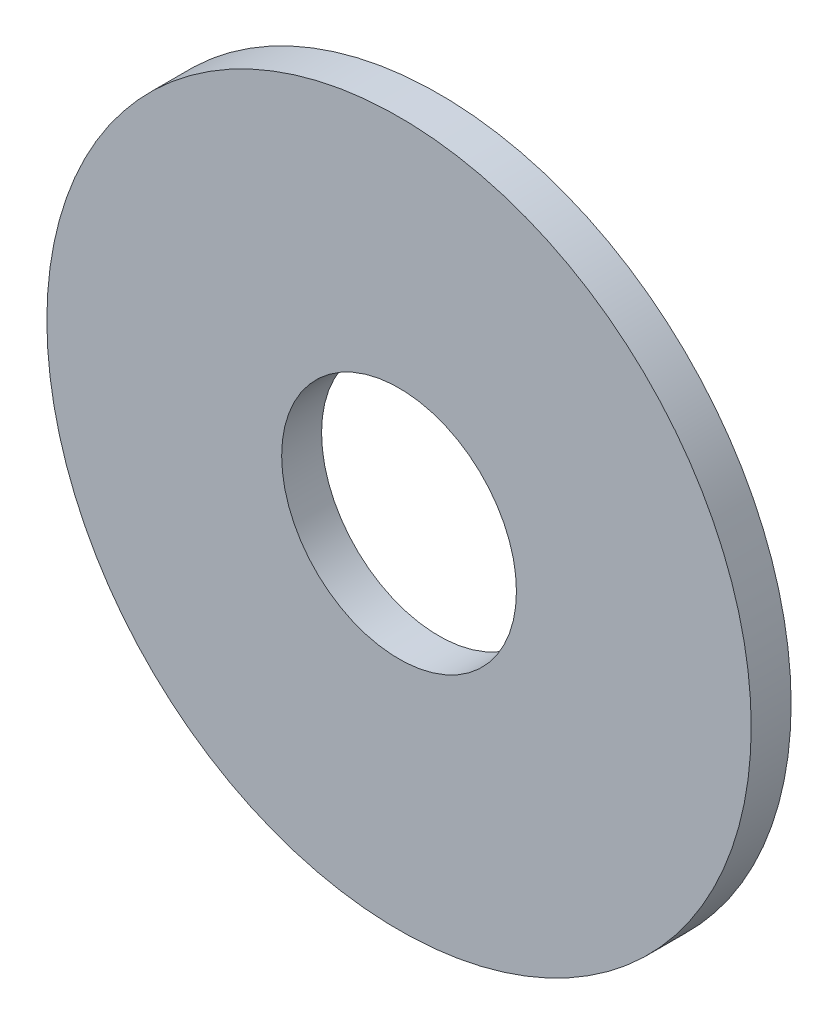
from build123d import *

# Parameters (mm, degrees)
SKETCH1_R           = 15
SKETCH1_R_2         = 5
BOSS_EXTRUDE1_DEPTH = 1.7


with BuildPart() as part:
    # Sketch1 → Boss-Extrude1 (new body)
    with BuildSketch(Plane.XY):
        Circle(SKETCH1_R)
        Circle(SKETCH1_R_2, mode=Mode.SUBTRACT)
    extrude(amount=BOSS_EXTRUDE1_DEPTH)


solid = part.part
